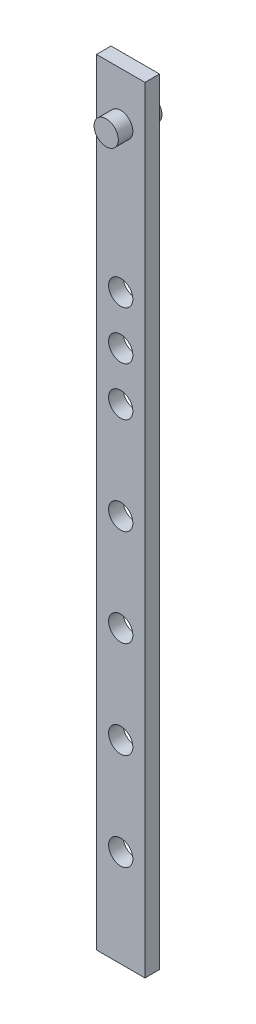
from build123d import *

# Parameters (mm, degrees)
SKETCH_1_W           = 10
SKETCH_1_H           = 160
SKETCH_1_R           = 2.5
EXTRUDE_1_DEPTH      = 3
EXTRUDE_2_DEPTH      = 3
EXTRUDE_2_DEPTH_BACK = 6
SKETCH_2_R           = 2.5


with BuildPart() as part:
    # 草圖1 → 填料-伸長1 (new body)
    with BuildSketch(Plane.XY):
        Rectangle(SKETCH_1_W, SKETCH_1_H)
        with Locations((0, -60)):
            Circle(SKETCH_1_R, mode=Mode.SUBTRACT)
        with Locations((0, -40)):
            Circle(SKETCH_1_R, mode=Mode.SUBTRACT)
        with Locations((0, -20)):
            Circle(SKETCH_1_R, mode=Mode.SUBTRACT)
        Circle(SKETCH_1_R, mode=Mode.SUBTRACT)
        with Locations((0, 20)):
            Circle(SKETCH_1_R, mode=Mode.SUBTRACT)
        with Locations((0, 40)):
            Circle(SKETCH_1_R, mode=Mode.SUBTRACT)
        with Locations((0, 30)):
            Circle(SKETCH_1_R, mode=Mode.SUBTRACT)
    extrude(amount=EXTRUDE_1_DEPTH)

    # 草圖2 → 填料-伸長2 (add, two sides: drawn at the far end of the back side and taken through both)
    with BuildSketch(Plane.XY.offset(3).offset(-EXTRUDE_2_DEPTH_BACK)):
        with Locations(Location((0, 70, 0), (0, 0, 180))):
            Circle(SKETCH_2_R)
    extrude(amount=EXTRUDE_2_DEPTH + EXTRUDE_2_DEPTH_BACK)


solid = part.part
